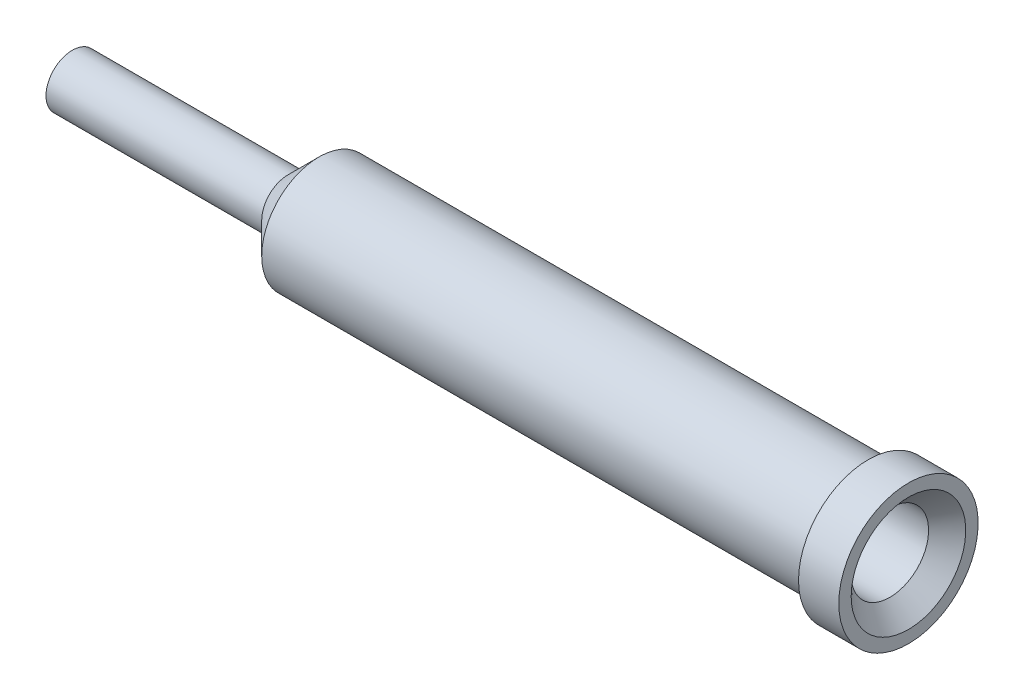
from build123d import *


with BuildPart() as part:
    # Sketch1 → Revolve2 (revolve)
    with BuildSketch(Plane(origin=(0, 0, 0), x_dir=(1, 0, 0), z_dir=(0, 1, 0)), mode=Mode.PRIVATE) as revolve2_sk:
        Polygon((-27, 0.85), (-20.034314575, 0.85), (-19.034314575, 1.85), (-1.3, 1.85), (-1.3, 2.25), (0, 2.25), (0, 1.85), (-0.6, 1.25), (-8.278312164, 1.25), (-9, 0), (-26, 0), (-26, 0.45), (-27, 0.45), align=None)
    revolve(revolve2_sk.sketch.rotate(Axis((-52.117092297, 0, 0), (1, 0, 0)), 180), axis=Axis((-52.117092297, 0, 0), (1, 0, 0)))


solid = part.part
